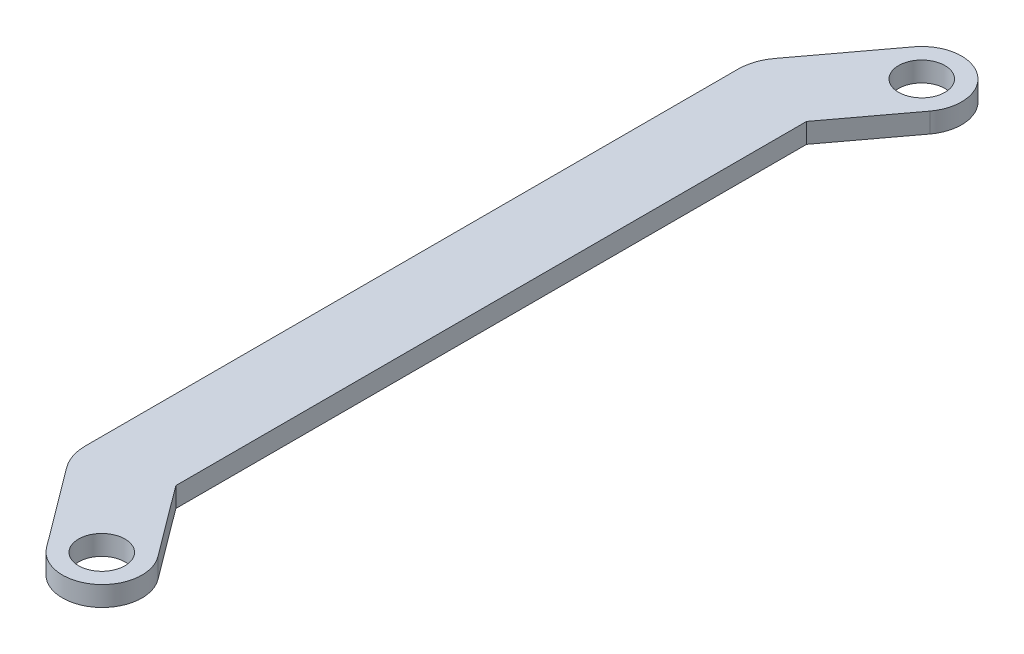
from build123d import *

# Parameters (mm, degrees)
SKETCH1_R           = 3.5
BOSS_EXTRUDE1_DEPTH = 3


with BuildPart() as part:
    # Sketch1 → Boss-Extrude1 (new body)
    with BuildSketch(Plane(origin=(0, 0, 0), x_dir=(1, 0, 0), z_dir=(0, 1, 0))):
        with BuildLine():
            Line((-4.808650437, 65.398437121), (-13.750473528, 53.416033622))
            ThreePointArc((-13.750473528, 53.416033622), (-14.783823427, 51.435125012), (-15.140381351, 49.229523647))
            Line((-15.140381351, 49.229523647), (-15.140381351, 0))
            Line((-15.140381351, 0), (-15.140381351, -49.229523647))
            ThreePointArc((-15.140381351, -49.229523647), (-14.783823427, -51.435125012), (-13.750473528, -53.416033622))
            Line((-13.750473528, -53.416033622), (-4.808650437, -65.398437121))
            ThreePointArc((-4.808650437, -65.398437121), (3.588437121, -66.618650437), (4.808650437, -58.221562879))
            Line((4.808650437, -58.221562879), (-3.140381351, -47.569539757))
            Line((-3.140381351, -47.569539757), (-3.140381351, 0))
            Line((-3.140381351, 0), (-3.140381351, 47.569539757))
            Line((-3.140381351, 47.569539757), (4.808650437, 58.221562879))
            ThreePointArc((4.808650437, 58.221562879), (3.588437121, 66.618650437), (-4.808650437, 65.398437121))
        make_face()
        with Locations(Location((0, 61.81, 0), (0, 0, 270))):
            Circle(SKETCH1_R, mode=Mode.SUBTRACT)
        with Locations(Location((0, -61.881, 0), (0, 0, 270))):
            Circle(SKETCH1_R, mode=Mode.SUBTRACT)
    extrude(amount=BOSS_EXTRUDE1_DEPTH)


solid = part.part
